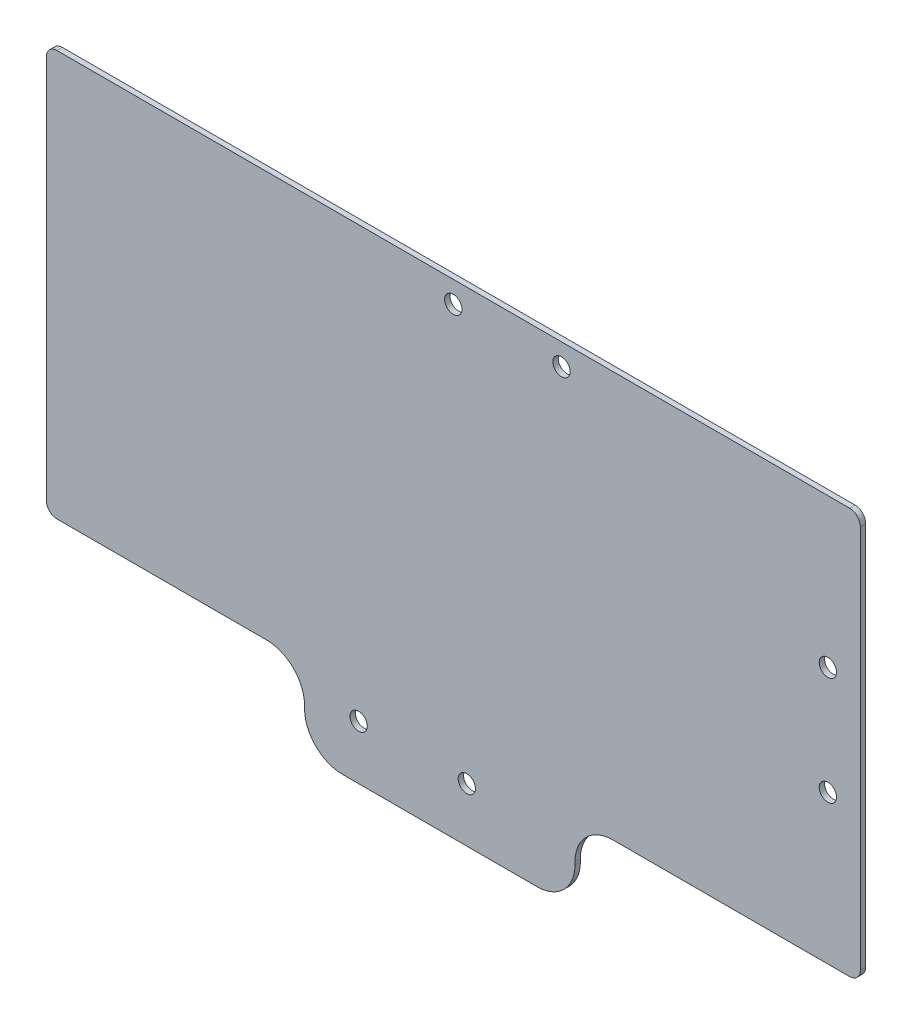
from build123d import *

# Parameters (mm, degrees)
SKETCH_1_W          = 60
SKETCH_1_H          = 14.5
SKETCH_1_R          = 1.6
EXTRUDE_1_DEPTH     = 1
SKETCH_2_W          = 120.5
SKETCH_2_H          = 75
SKETCH_2_R          = 1.6
EXTRUDE_2_DEPTH     = 1
SKETCH_3_R          = 1.6
CUT_EXTRUDE_1_DEPTH = 10
SKETCH_4_W          = 30
SKETCH_4_H          = 75
EXTRUDE_3_DEPTH     = 1
FILLET_1_R          = 7
SKETCH_5_W          = 10
SKETCH_5_H          = 14.5
CUT_EXTRUDE_2_DEPTH = 10
FILLET_2_R          = 7
FILLET_3_R          = 2


with BuildPart() as part:
    # 草图1 → 凸台-拉伸1 (new body)
    with BuildSketch(Plane.XY):
        with Locations((0, -2.75)):
            Rectangle(SKETCH_1_W, SKETCH_1_H)
        with Locations((-10, 0)):
            Circle(SKETCH_1_R, mode=Mode.SUBTRACT)
        with Locations((10, 0)):
            Circle(SKETCH_1_R, mode=Mode.SUBTRACT)
    extrude(amount=EXTRUDE_1_DEPTH)

    # 草图2 → 凸台-拉伸2 (add)
    with BuildSketch(Plane(origin=(0, 0, 0), x_dir=(-1, 0, 0), z_dir=(0, 0, -1))):
        with Locations((-22.5, 42)):
            Rectangle(SKETCH_2_W, SKETCH_2_H)
        with Locations((-76.75, 52)):
            Circle(SKETCH_2_R, mode=Mode.SUBTRACT)
        with Locations((-76.75, 32)):
            Circle(SKETCH_2_R, mode=Mode.SUBTRACT)
    extrude(amount=-EXTRUDE_2_DEPTH)

    # 草图3 → 切除-拉伸1 (cut)
    with BuildSketch(Plane(origin=(0, 0, 0), x_dir=(-1, 0, 0), z_dir=(0, 0, -1))):
        with Locations((-27.5, 75.5)):
            Circle(SKETCH_3_R)
        with Locations((-7.5, 75.5)):
            Circle(SKETCH_3_R)
    extrude(amount=-CUT_EXTRUDE_1_DEPTH, mode=Mode.SUBTRACT)

    # 草图4 → 凸台-拉伸3 (add)
    with BuildSketch(Plane(origin=(0, 0, 0), x_dir=(-1, 0, 0), z_dir=(0, 0, -1))):
        with Locations((52.75, 42)):
            Rectangle(SKETCH_4_W, SKETCH_4_H)
    extrude(amount=-EXTRUDE_3_DEPTH)

    # 圆角1
    fillet_1_edges = [part.edges().sort_by_distance(p)[0] for p in [
        (30, -10, 0.5),
        (30, 4.5, 0.5),
    ]]
    fillet(fillet_1_edges, radius=FILLET_1_R)

    # 草图5 → 切除-拉伸2 (cut)
    with BuildSketch(Plane(origin=(0, 0, 0), x_dir=(-1, 0, 0), z_dir=(0, 0, -1))):
        with Locations((25, -2.75)):
            Rectangle(SKETCH_5_W, SKETCH_5_H)
    extrude(amount=-CUT_EXTRUDE_2_DEPTH, mode=Mode.SUBTRACT)

    # 圆角2
    fillet_2_edges = [part.edges().sort_by_distance(p)[0] for p in [
        (-20, -10, 0.5),
        (-20, 4.5, 0.5),
    ]]
    fillet(fillet_2_edges, radius=FILLET_2_R)

    # 圆角3
    fillet_3_edges = [part.edges().sort_by_distance(p)[0] for p in [
        (82.75, 4.5, 0.5),
        (82.75, 79.5, 0.5),
        (-67.75, 79.5, 0.5),
        (-67.75, 4.5, 0.5),
    ]]
    fillet(fillet_3_edges, radius=FILLET_3_R)


solid = part.part
